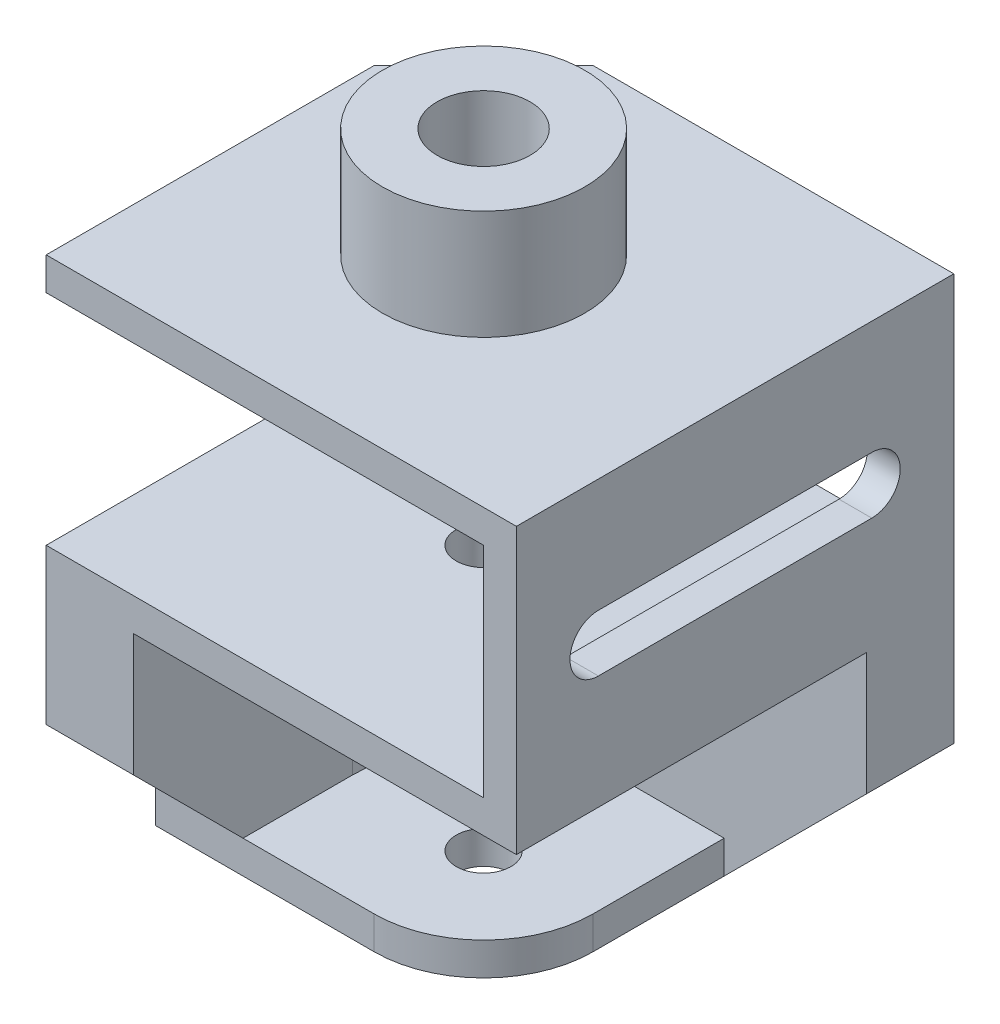
from build123d import *

# Parameters (mm, degrees)
SKETCH1_W           = 40
SKETCH1_H           = 40
SKETCH1_R           = 4.25
BOSS_EXTRUDE1_DEPTH = 3
SKETCH2_R           = 9.25
SKETCH2_R_2         = 4.25
BOSS_EXTRUDE2_DEPTH = 10
SKETCH3_W           = 40
SKETCH3_H           = 23
BOSS_EXTRUDE3_DEPTH = 3
CUT_EXTRUDE1_DEPTH  = 3
SKETCH5_W           = 43
SKETCH5_H           = 40
BOSS_EXTRUDE4_DEPTH = 3
SKETCH6_R           = 2.5
CUT_EXTRUDE2_DEPTH  = 10
SKETCH7_R           = 6
SKETCH7_R_2         = 2.5
BOSS_EXTRUDE5_DEPTH = 1
BOSS_EXTRUDE6_DEPTH = 21.2
CHAMFER2_SIZE       = 10
SKETCH10_R          = 2.5
BOSS_EXTRUDE7_DEPTH = 3
CUT_EXTRUDE3_DEPTH  = 31
BOSS_EXTRUDE8_DEPTH = 8


with BuildPart() as part:
    # Sketch1 → Boss-Extrude1 (new body)
    with BuildSketch(Plane(origin=(0, 0, 0), x_dir=(1, 0, 0), z_dir=(0, 1, 0))):
        Rectangle(SKETCH1_W, SKETCH1_H)
        with Locations(Location((0, 0, 0), (0, 0, 270))):
            Circle(SKETCH1_R, mode=Mode.SUBTRACT)
    extrude(amount=BOSS_EXTRUDE1_DEPTH)

    # Sketch2 → Boss-Extrude2 (add)
    with BuildSketch(Plane(origin=(0, 3, 0), x_dir=(1, 0, 0), z_dir=(0, 1, 0))):
        with Locations(Location((0, 0, 0), (0, 0, 270))):
            Circle(SKETCH2_R)
        with Locations(Location((0, 0, 0), (0, 0, 270))):
            Circle(SKETCH2_R_2, mode=Mode.SUBTRACT)
    extrude(amount=BOSS_EXTRUDE2_DEPTH)

    # Sketch3 → Boss-Extrude3 (add)
    with BuildSketch(Plane(origin=(20, 0, 0), x_dir=(0, 0, -1), z_dir=(1, 0, 0))):
        with Locations((0, -8.5)):
            Rectangle(SKETCH3_W, SKETCH3_H)
    extrude(amount=BOSS_EXTRUDE3_DEPTH)

    # Sketch4 → Cut-Extrude1 (cut)
    with BuildSketch(Plane.ZY.offset(-20)):
        with BuildLine():
            Line((-12.5, -7.4), (12.5, -7.4))
            ThreePointArc((12.5, -7.4), (15.1, -10), (12.5, -12.6))
            Line((12.5, -12.6), (-12.5, -12.6))
            ThreePointArc((-12.5, -12.6), (-15.1, -10), (-12.5, -7.4))
        make_face()
    extrude(amount=-CUT_EXTRUDE1_DEPTH, mode=Mode.SUBTRACT)

    # Sketch5 → Boss-Extrude4 (add)
    with BuildSketch(Plane(origin=(0, -20, 0), x_dir=(-1, 0, 0), z_dir=(0, -1, 0))):
        with Locations((-1.5, 0)):
            Rectangle(SKETCH5_W, SKETCH5_H)
    extrude(amount=BOSS_EXTRUDE4_DEPTH)

    # Sketch6 → Cut-Extrude2 (cut)
    with BuildSketch(Plane(origin=(0, -20, 0), x_dir=(1, 0, 0), z_dir=(0, 1, 0))):
        with Locations(Location((0, 0, 0), (0, 0, 270))):
            Circle(SKETCH6_R)
    extrude(amount=-CUT_EXTRUDE2_DEPTH, mode=Mode.SUBTRACT)

    # Sketch7 → Boss-Extrude5 (add)
    with BuildSketch(Plane(origin=(0, -23, 0), x_dir=(-1, 0, 0), z_dir=(0, -1, 0))):
        with Locations(Location((0, 0, 0), (0, 0, 270))):
            Circle(SKETCH7_R)
        with Locations(Location((0, 0, 0), (0, 0, 270))):
            Circle(SKETCH7_R_2, mode=Mode.SUBTRACT)
    extrude(amount=BOSS_EXTRUDE5_DEPTH)

    # Sketch9 → Boss-Extrude6 (add)
    with BuildSketch(Plane.XZ.offset(23)):
        with BuildLine():
            Line((23, -12), (0, -12))
            ThreePointArc((0, -12), (-8.485281374, -8.485281374), (-12, 0))
            Line((-12, 0), (-12, 20))
            Line((-12, 20), (-20, 20))
            Line((-20, 20), (-20, -10))
            Line((-20, -10), (-10, -20))
            Line((-10, -20), (23, -20))
            Line((23, -20), (23, -12))
        make_face()
    extrude(amount=BOSS_EXTRUDE6_DEPTH)

    # Chamfer2
    chamfer2_edges = [part.edges().sort_by_distance(p)[0] for p in [
        (-16, -44.2, 20),
        (23, -44.2, -16),
    ]]
    chamfer(chamfer2_edges, length=CHAMFER2_SIZE)

    # Sketch10 → Boss-Extrude7 (add)
    with BuildSketch(Plane.XZ.offset(44.2)):
        with BuildLine():
            Line((0, 10), (-12, 10))
            Line((-12, 10), (-20, 10))
            Line((-20, 10), (-20, -10))
            Line((-20, -10), (-10, -20))
            Line((-10, -20), (10, -20))
            Line((10, -20), (10, 0))
            ThreePointArc((10, 0), (7.071067812, 7.071067812), (0, 10))
        make_face()
        with Locations(Location((0, 0, 0), (0, 0, 90))):
            Circle(SKETCH10_R, mode=Mode.SUBTRACT)
    extrude(amount=BOSS_EXTRUDE7_DEPTH)

    # Sketch11 → Cut-Extrude3 (cut)
    with BuildSketch(Plane.XZ.offset(23)):
        Polygon((-10, -20), (-20, -10), (-20, -20), align=None)
    extrude(amount=-CUT_EXTRUDE3_DEPTH, mode=Mode.SUBTRACT)

    # Sketch12 → Boss-Extrude8 (add)
    with BuildSketch(Plane(origin=(0, 0, -20), x_dir=(-1, 0, 0), z_dir=(0, 0, -1))):
        Polygon((-10, -47.2), (-13, -44.2), (-10, -44.2), align=None)
    extrude(amount=-BOSS_EXTRUDE8_DEPTH)


solid = part.part
